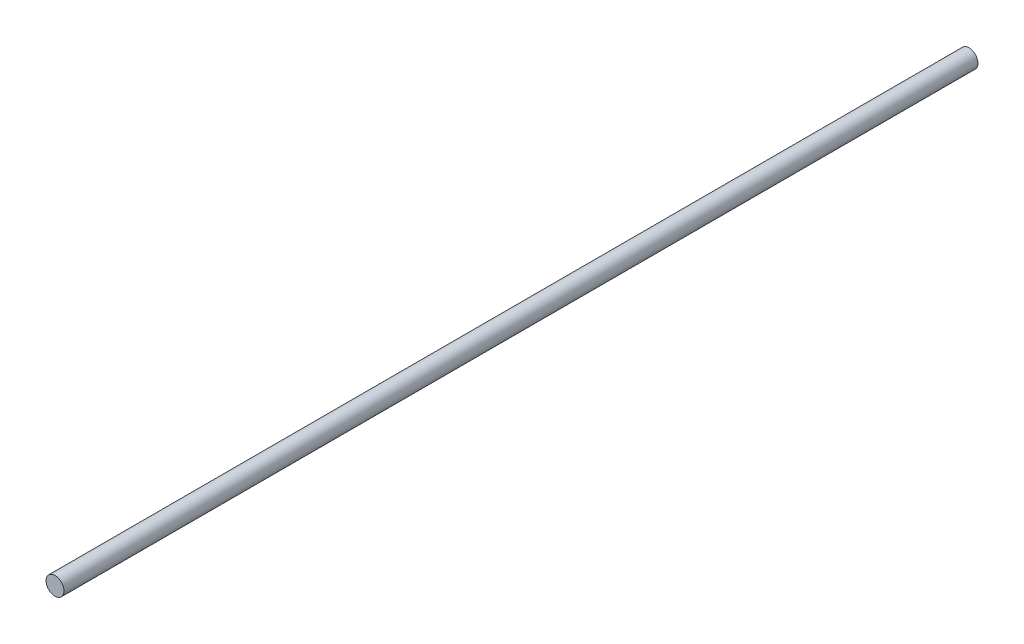
from build123d import *

# Parameters (mm, degrees)
ESQUISSE1_R        = 1.5
BOSS_EXTRU_1_DEPTH = 152.5


with BuildPart() as part:
    # Esquisse1 → Boss.-Extru.1 (new body)
    with BuildSketch(Plane.XY):
        with Locations((-1.151263456, 0.494133616)):
            Circle(ESQUISSE1_R)
    extrude(amount=BOSS_EXTRU_1_DEPTH)


solid = part.part
